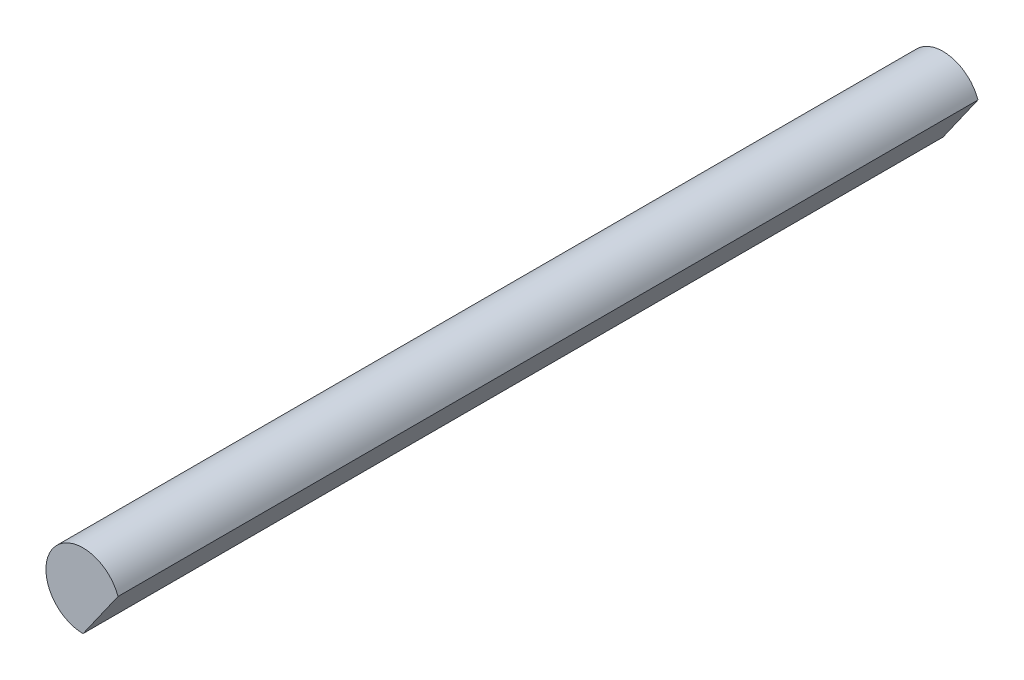
from build123d import *

# Parameters (mm, degrees)
BOSS_EXTRUDE1_DEPTH = 34.74


with BuildPart() as part:
    # Sketch1 → Boss-Extrude1 (new body)
    with BuildSketch(Plane.XY):
        with BuildLine():
            Line((-0.00170223, -1.499999034), (1.411890351, 0.506523085))
            ThreePointArc((1.411890351, 0.506523085), (-1.22625054, 0.86389213), (-0.00170223, -1.499999034))
        make_face()
    extrude(amount=BOSS_EXTRUDE1_DEPTH)


solid = part.part
